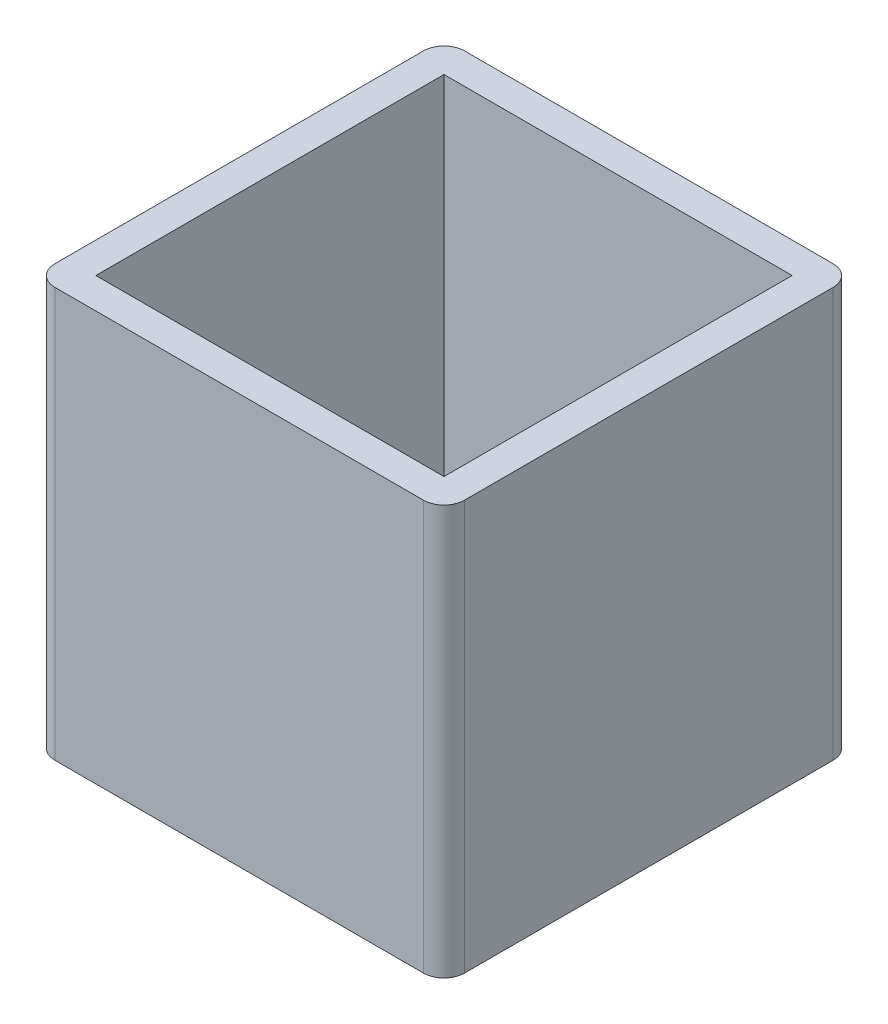
from build123d import *

# Parameters (mm, degrees)
SKETCH_1_W          = 40
SKETCH_1_H          = 40
EXTRUDE_1_DEPTH     = 40
SKETCH_2_W          = 34
SKETCH_2_H          = 34
CUT_EXTRUDE_1_DEPTH = 37
FILLET_1_R          = 2


with BuildPart() as part:
    # 草图1 → 凸台-拉伸1 (new body)
    with BuildSketch(Plane(origin=(0, 0, 0), x_dir=(1, 0, 0), z_dir=(0, 1, 0))):
        with Locations((20, -20)):
            Rectangle(SKETCH_1_W, SKETCH_1_H)
    extrude(amount=EXTRUDE_1_DEPTH)

    # 草图2 → 切除-拉伸1 (cut)
    with BuildSketch(Plane(origin=(0, 40, 0), x_dir=(1, 0, 0), z_dir=(0, 1, 0))):
        with Locations((20, -20)):
            Rectangle(SKETCH_2_W, SKETCH_2_H)
    extrude(amount=-CUT_EXTRUDE_1_DEPTH, mode=Mode.SUBTRACT)

    # 圆角1
    fillet_1_edges = [part.edges().sort_by_distance(p)[0] for p in [
        (0, 20, 0),
        (40, 20, 0),
        (40, 20, 40),
        (0, 20, 40),
    ]]
    fillet(fillet_1_edges, radius=FILLET_1_R)


solid = part.part
